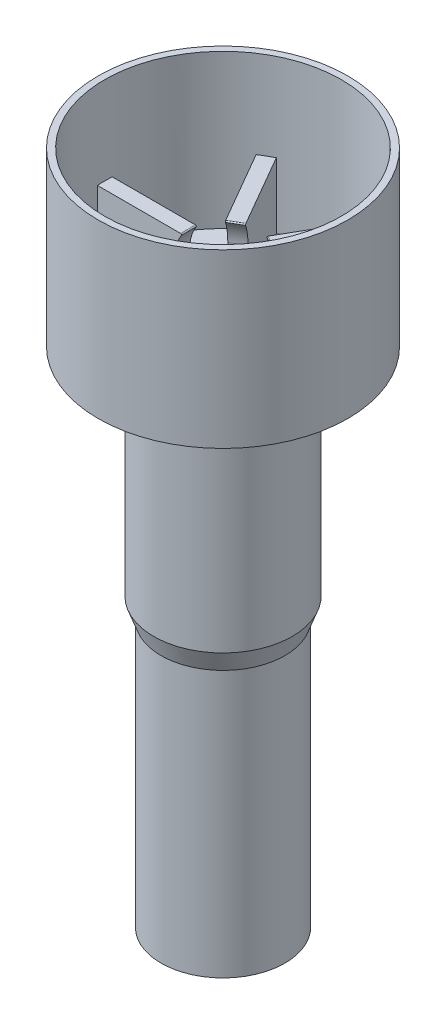
from build123d import *

# Parameters (mm, degrees)
BOSS_EXTRUDE1_DEPTH      = 0.4
FILLET1_R                = 0.05
CIRPATTERN1_COUNT        = 6
FILLET1_OF_CIRPATTERN1_R = 0.05


with BuildPart() as part:
    # Sketch1 → Revolve1 (revolve)
    with BuildSketch(Plane.XY):
        Polygon((-6.4, 36.5), (-6.4, 28.2), (-2.1, 28.2), (-2.1, 24), (-1.5, 24), (-1.5, 23), (-2.15, 23), (-2.15, 0), (-3.35, 0), (-3.35, 14.401009032), (-3.75, 15.5), (-3.75, 27.2), (-6.75, 27.2), (-6.75, 36.5), align=None)
    revolve(axis=Axis((0, 0, 0), (0, 1, 0)))

    # Sketch3 → Boss-Extrude1 (add, symmetric)
    with BuildSketch(Plane.XY):
        with BuildLine():
            Line((-6.4, 31.75), (-6.4, 28.2))
            Line((-6.4, 28.2), (-2.2, 28.2))
            Line((-2.2, 28.2), (-2.2, 30.5))
            ThreePointArc((-2.2, 30.5), (-2.097563242, 31.156220237), (-1.8, 31.75))
            Line((-1.8, 31.75), (-6.4, 31.75))
        make_face()
    boss_extrude1 = extrude(amount=BOSS_EXTRUDE1_DEPTH, both=True)

    # Fillet1
    fillet1_edges = [part.edges().sort_by_distance(p)[0] for p in [
        (-1.8, 31.75, 0),
    ]]
    fillet(fillet1_edges, radius=FILLET1_R)

    # CirPattern1: Boss-Extrude1 ×6 about axis
    cirpattern1_axis = Axis((0, 0, 0), (0, 1, 0))
    for i in range(1, CIRPATTERN1_COUNT):
        add(boss_extrude1.rotate(cirpattern1_axis, i * 360 / CIRPATTERN1_COUNT))

    # Fillet1 of CirPattern1
    fillet1_of_cirpattern1_edges = [part.edges().sort_by_distance(p)[0] for p in [
        (-0.9, 31.75, 1.558845727),
        (0.9, 31.75, 1.558845727),
        (1.8, 31.75, 0),
        (0.9, 31.75, -1.558845727),
        (-0.9, 31.75, -1.558845727),
    ]]
    fillet(fillet1_of_cirpattern1_edges, radius=FILLET1_OF_CIRPATTERN1_R)


solid = part.part
